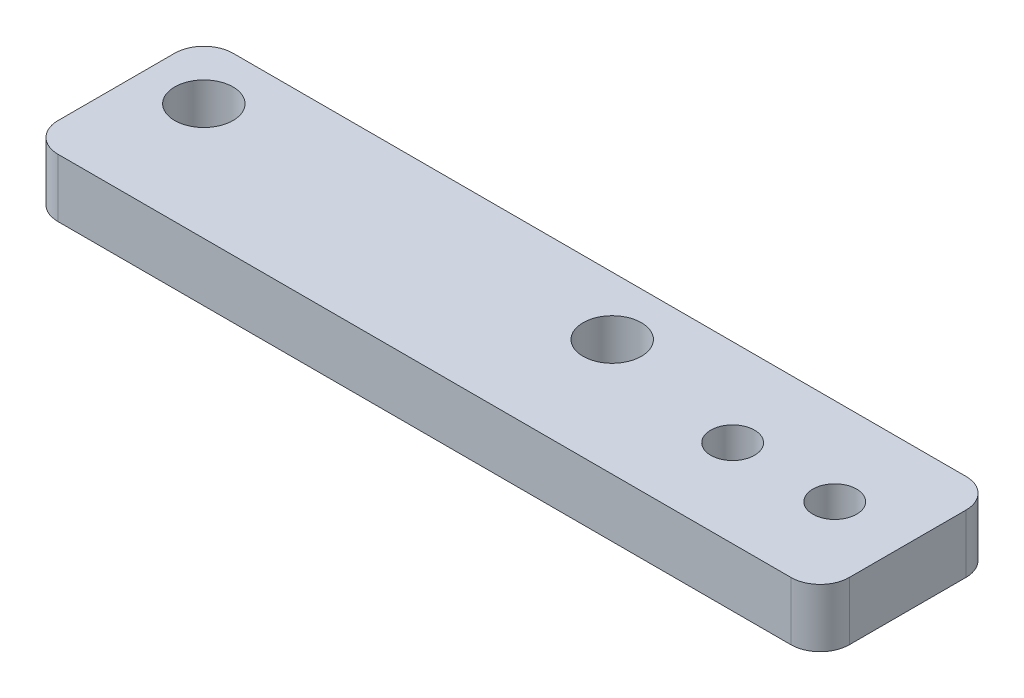
from build123d import *

# Parameters (mm, degrees)
SKETCH1_W           = 54.256826994
SKETCH1_H           = 12
SKETCH1_R           = 1.5
SKETCH1_R_2         = 2
BOSS_EXTRUDE1_DEPTH = 4
FILLET1_R           = 2


with BuildPart() as part:
    # Sketch1 → Boss-Extrude1 (new body)
    with BuildSketch(Plane(origin=(0, 0, 0), x_dir=(1, 0, 0), z_dir=(0, 1, 0))):
        Rectangle(SKETCH1_W, SKETCH1_H)
        with Locations(Location((15.128413497, 0, 0), (0, 0, 270))):
            Circle(SKETCH1_R, mode=Mode.SUBTRACT)
        with Locations(Location((22.128413497, 0, 0), (0, 0, 270))):
            Circle(SKETCH1_R, mode=Mode.SUBTRACT)
        with Locations(Location((-23.128413497, 2, 0), (0, 0, 270))):
            Circle(SKETCH1_R_2, mode=Mode.SUBTRACT)
        with Locations(Location((4.871586503, 2, 0), (0, 0, 270))):
            Circle(SKETCH1_R_2, mode=Mode.SUBTRACT)
    extrude(amount=BOSS_EXTRUDE1_DEPTH)

    # Fillet1
    fillet1_edges = [part.edges().sort_by_distance(p)[0] for p in [
        (27.128413497, 2, 6),
        (-27.128413497, 2, 6),
        (-27.128413497, 2, -6),
        (27.128413497, 2, -6),
    ]]
    fillet(fillet1_edges, radius=FILLET1_R)


solid = part.part
